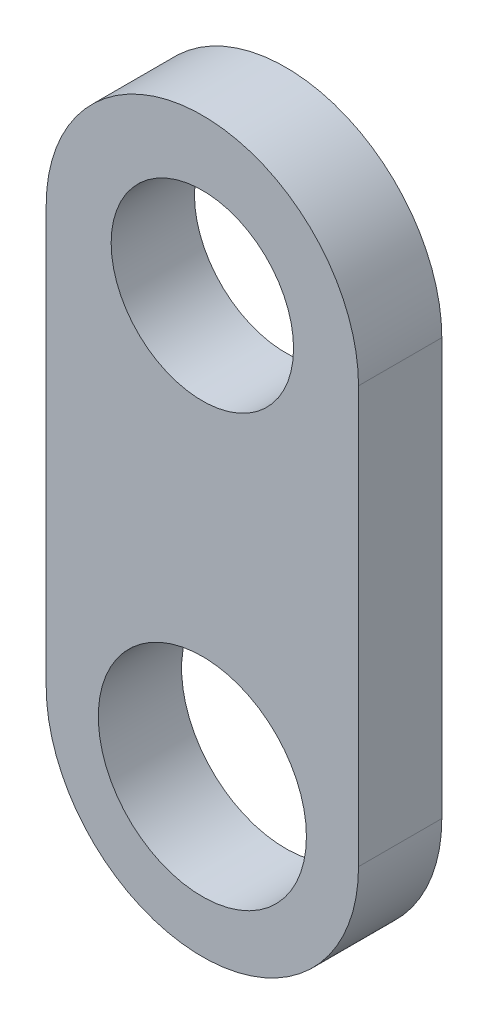
from build123d import *

# Parameters (mm, degrees)
SKETCH2_R           = 11.1252
SKETCH2_R_2         = 12.69365
BOSS_EXTRUDE1_DEPTH = 5.08


with BuildPart() as part:
    # Sketch2 → Boss-Extrude1 (new, symmetric)
    with BuildSketch(Plane.XY):
        with BuildLine():
            Line((-19.05, 0), (-19.05, 50.8))
            ThreePointArc((-19.05, 50.8), (0, 69.85), (19.05, 50.8))
            Line((19.05, 50.8), (19.05, 0))
            ThreePointArc((19.05, 0), (0, -19.05), (-19.05, 0))
        make_face()
        with Locations((0, 50.8)):
            Circle(SKETCH2_R, mode=Mode.SUBTRACT)
        Circle(SKETCH2_R_2, mode=Mode.SUBTRACT)
    extrude(amount=BOSS_EXTRUDE1_DEPTH, both=True)


solid = part.part
